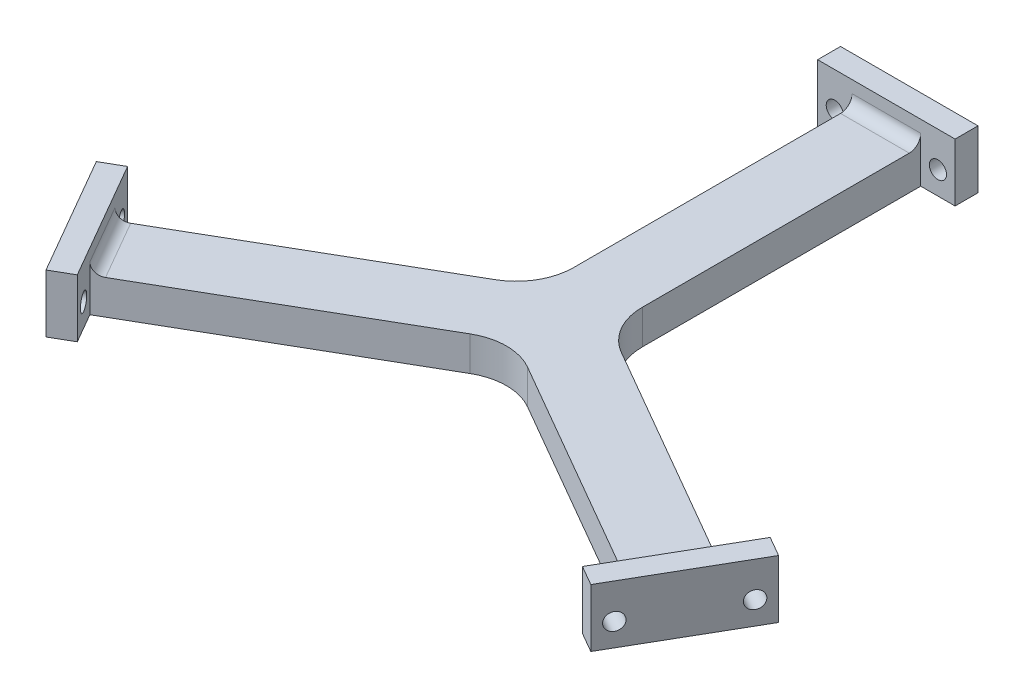
from build123d import *

# Parameters (mm, degrees)
SKETCH_1_W                       = 12
SKETCH_1_H                       = 61.85
EXTRUDE_1_DEPTH                  = 6
SKETCH_2_W                       = 24
SKETCH_2_H                       = 10.13
EXTRUDE_2_DEPTH                  = 4
SKETCH_3_R                       = 1.5
CUT_EXTRUDE_1_DEPTH              = 4
FILLET_1_R                       = 2
PATTERN_CIRCULAR_1_COUNT         = 3
FILLET_1_OF_PATTERN_CIRCULAR_1_R = 2
FILLET_2_R                       = 10


with BuildPart() as part:
    # 草图1 → 凸台-拉伸1 (new body)
    with BuildSketch(Plane(origin=(0, 0, 0), x_dir=(1, 0, 0), z_dir=(0, 1, 0))):
        with Locations((0, 30.925)):
            Rectangle(SKETCH_1_W, SKETCH_1_H)
    extrude_1 = extrude(amount=EXTRUDE_1_DEPTH)

    # 草图2 → 凸台-拉伸2 (add)
    with BuildSketch(Plane(origin=(0, 0, -61.85), x_dir=(-1, 0, 0), z_dir=(0, 0, -1))):
        with Locations((0, 5.065)):
            Rectangle(SKETCH_2_W, SKETCH_2_H)
    extrude_2 = extrude(amount=-EXTRUDE_2_DEPTH)

    # 草图3 → 切除-拉伸1 (cut)
    with BuildSketch(Plane.XY.offset(-57.85)):
        with Locations((-9, 4)):
            Circle(SKETCH_3_R)
        with Locations((9, 4)):
            Circle(SKETCH_3_R)
    cut_extrude_1 = extrude(amount=-CUT_EXTRUDE_1_DEPTH, mode=Mode.SUBTRACT)

    # 圆角1
    fillet_1_edges = [part.edges().sort_by_distance(p)[0] for p in [
        (0, 6, -57.85),
    ]]
    fillet(fillet_1_edges, radius=FILLET_1_R)

    # 阵列(圆周)1: 凸台-拉伸1, 凸台-拉伸2, 切除-拉伸1 ×3 about axis
    pattern_circular_1_axis = Axis((0, 6.3, 0), (0, -1, 0))
    add([extrude_1.rotate(pattern_circular_1_axis, i * 360 / PATTERN_CIRCULAR_1_COUNT) for i in range(1, PATTERN_CIRCULAR_1_COUNT)])
    add([extrude_2.rotate(pattern_circular_1_axis, i * 360 / PATTERN_CIRCULAR_1_COUNT) for i in range(1, PATTERN_CIRCULAR_1_COUNT)])
    add([cut_extrude_1.rotate(pattern_circular_1_axis, i * 360 / PATTERN_CIRCULAR_1_COUNT) for i in range(1, PATTERN_CIRCULAR_1_COUNT)], mode=Mode.SUBTRACT)

    # 圆角1 of 阵列(圆周)1
    fillet_1_of_pattern_circular_1_edges = [part.edges().sort_by_distance(p)[0] for p in [
        (50.099569609, 6, 28.925),
        (-50.099569609, 6, 28.925),
    ]]
    fillet(fillet_1_of_pattern_circular_1_edges, radius=FILLET_1_OF_PATTERN_CIRCULAR_1_R)

    # 圆角2
    fillet_2_edges = [part.edges().sort_by_distance(p)[0] for p in [
        (-6, 3, -3.464101615),
        (6, 3, -3.464101615),
        (0, 3, 6.92820323),
    ]]
    fillet(fillet_2_edges, radius=FILLET_2_R)


solid = part.part
